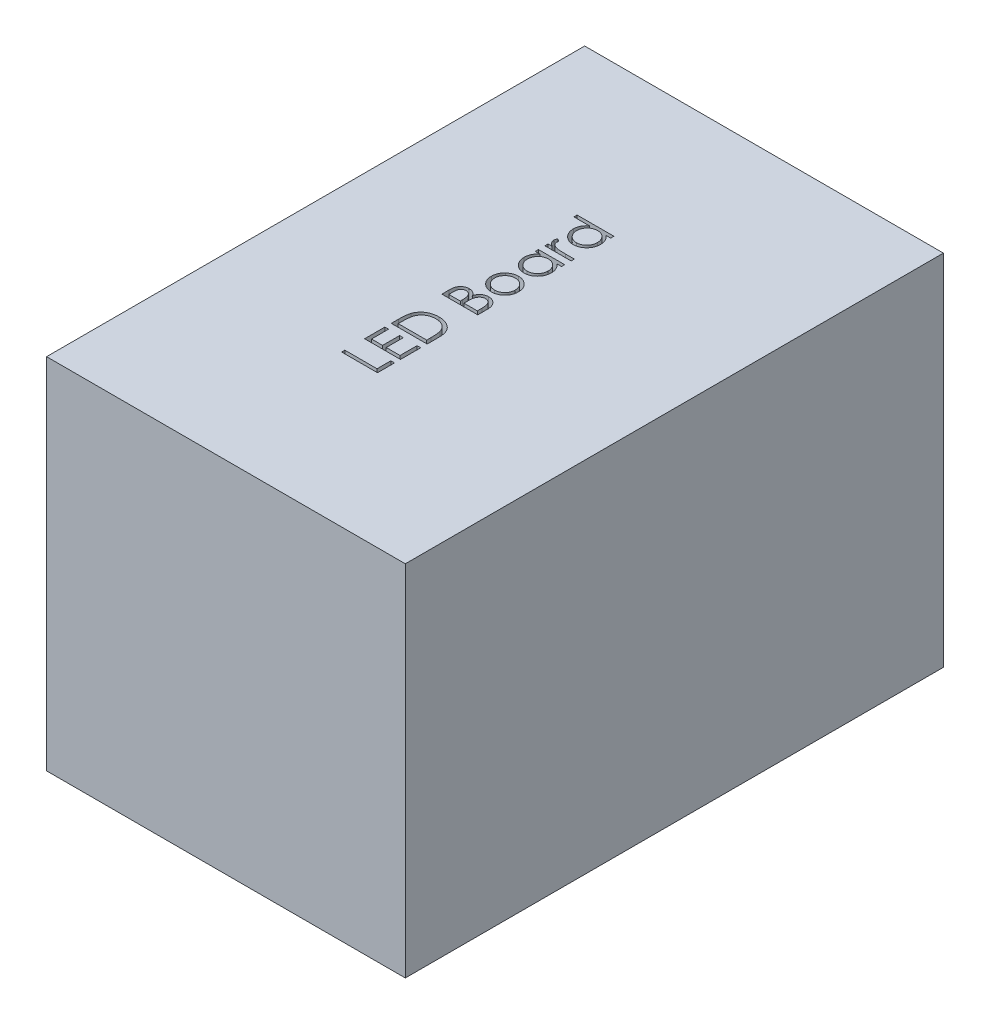
from build123d import *

# Parameters (mm, degrees)
SKETCH1_W           = 20
SKETCH1_H           = 30
BOSS_EXTRUDE1_DEPTH = 20
CUT_EXTRUDE1_DEPTH  = 2


with BuildPart() as part:
    # Sketch1 → Boss-Extrude1 (new body)
    with BuildSketch(Plane(origin=(0, 0, 0), x_dir=(1, 0, 0), z_dir=(0, 1, 0))):
        Rectangle(SKETCH1_W, SKETCH1_H)
    extrude(amount=BOSS_EXTRUDE1_DEPTH)

    # Sketch2 → Cut-Extrude1 (cut)
    # profile 1 of 8: a face of its own
    with BuildSketch(Plane(origin=(0, 20, 0), x_dir=(1, 0, 0), z_dir=(0, 1, 0))):
        Polygon((-2, -6.551282051), (-2, -6.371794872), (-0.205128205, -6.371794872), (-0.205128205, -5.602564103), (0, -5.602564103), (0, -6.551282051), align=None)
    # profile 2 of 8: a face of its own
    with BuildSketch(Plane(origin=(0, 20, 0), x_dir=(1, 0, 0), z_dir=(0, 1, 0))):
        Polygon((-2, -5.269230769), (-2, -4.141025641), (-1.794871795, -4.141025641), (-1.794871795, -5.08974359), (-1.179487179, -5.08974359), (-1.179487179, -4.141025641), (-0.974358974, -4.141025641), (-0.974358974, -5.08974359), (-0.205128205, -5.08974359), (-0.205128205, -4.141025641), (0, -4.141025641), (0, -5.269230769), align=None)
    # profile 3 of 8: a face of its own
    with BuildSketch(Plane(origin=(0, 20, 0), x_dir=(1, 0, 0), z_dir=(0, 1, 0))):
        with BuildLine():
            Line((0, -3.782051282), (-2, -3.782051282))
            Line((-2, -3.782051282), (-2, -3.378205128))
            add(Edge.make_bspline(
                [(-2, -3.378205128), (-1.999747103, -3.343079992), (-1.999258507, -3.275218412), (-1.996160569, -3.177154156), (-1.990680303, -3.086420578), (-1.982697717, -3.003316087), (-1.972895983, -2.927612537), (-1.960610038, -2.859521904), (-1.946102512, -2.798692108), (-1.933733683, -2.761280999), (-1.927884615, -2.743589744)],
                knots=[0, 0, 0, 0, 1.314313732, 2.53924729, 3.670748893, 4.714932338, 5.66265055, 6.526160246, 7.303039223, 8, 8, 8, 8], degree=3))
            add(Edge.make_bspline(
                [(-1.927884615, -2.743589744), (-1.919069815, -2.720447809), (-1.901640105, -2.674688721), (-1.868710928, -2.609572047), (-1.831553985, -2.54806308), (-1.789314193, -2.490652223), (-1.742543133, -2.437195425), (-1.691574936, -2.38708597), (-1.635277366, -2.341559304), (-1.574652486, -2.299906351), (-1.510477072, -2.262340673), (-1.442856226, -2.229690386), (-1.372138034, -2.202573639), (-1.298517891, -2.180063273), (-1.221834263, -2.162322426), (-1.141997764, -2.150218469), (-1.059323942, -2.142235045), (-1.003224249, -2.141432731), (-0.974759615, -2.141025641)],
                knots=[0, 0, 0, 0, 0.984741985, 1.947153288, 2.898543998, 3.841229145, 4.778974371, 5.722123648, 6.681464302, 7.655713756, 8.646344578, 9.637374342, 10.639946623, 11.656849581, 12.698333139, 13.76849723, 14.867749466, 16, 16, 16, 16], degree=3))
            add(Edge.make_bspline(
                [(-0.974759615, -2.141025641), (-0.950038908, -2.141385051), (-0.901324172, -2.142093307), (-0.829529371, -2.148452912), (-0.759864485, -2.157696538), (-0.692661185, -2.172007455), (-0.62733093, -2.189380512), (-0.564569078, -2.211645038), (-0.503803275, -2.237153612), (-0.445842752, -2.266886928), (-0.390965868, -2.299573558), (-0.339195829, -2.334432869), (-0.291681428, -2.372255442), (-0.247177572, -2.411921845), (-0.206873133, -2.454388626), (-0.170033415, -2.499138758), (-0.137275193, -2.546346154), (-0.108083705, -2.596303039), (-0.081978565, -2.649676602), (-0.060203746, -2.70814571), (-0.041344529, -2.771433407), (-0.026342022, -2.839900607), (-0.014242392, -2.913303108), (-0.006186412, -2.99184453), (-0.000722936, -3.075376442), (-0.000245658, -3.132736221), (0, -3.162259615)],
                knots=[0, 0, 0, 0, 1.106010661, 2.179509527, 3.223302912, 4.248870533, 5.252098245, 6.246278179, 7.226402005, 8.199283979, 9.158616973, 10.083547221, 10.989831858, 11.874256832, 12.749262829, 13.607058236, 14.46581075, 15.317568432, 16.194266721, 17.121067875, 18.106207572, 19.147242834, 20.255495536, 21.43354536, 22.679031616, 24, 24, 24, 24], degree=3))
            Line((0, -3.162259615), (0, -3.782051282))
        make_face()
        with BuildLine():
            Line((-0.205128205, -3.602564103), (-0.205128205, -3.372996795))
            add(Edge.make_bspline(
                [(-0.205128205, -3.372996795), (-0.205269974, -3.340009154), (-0.205542649, -3.276561841), (-0.207935336, -3.1853287), (-0.211845015, -3.101969045), (-0.217316488, -3.026471039), (-0.224555697, -2.958877311), (-0.23262707, -2.899046597), (-0.242682756, -2.847175021), (-0.25179759, -2.815786771), (-0.256009615, -2.801282051)],
                knots=[0, 0, 0, 0, 1.375205317, 2.645023457, 3.804390687, 4.853969522, 5.800190428, 6.637939096, 7.370582563, 8, 8, 8, 8], degree=3))
            add(Edge.make_bspline(
                [(-0.256009615, -2.801282051), (-0.262439076, -2.783025842), (-0.27514443, -2.746949474), (-0.298320254, -2.695017453), (-0.325772801, -2.646584778), (-0.35628862, -2.60080799), (-0.390942606, -2.558334235), (-0.428986447, -2.518668496), (-0.470593957, -2.481859335), (-0.515697668, -2.448473714), (-0.563808484, -2.418234025), (-0.615011493, -2.39227452), (-0.668586858, -2.369667192), (-0.724968301, -2.351766282), (-0.783742578, -2.337652199), (-0.845214457, -2.327759016), (-0.909329543, -2.321617179), (-0.952977429, -2.320884954), (-0.975160256, -2.320512821)],
                knots=[0, 0, 0, 0, 0.998590647, 1.973329978, 2.929871262, 3.868367705, 4.809062953, 5.754642869, 6.701828697, 7.672172887, 8.647399344, 9.630604387, 10.631475358, 11.644913558, 12.679592956, 13.747988925, 14.855477812, 16, 16, 16, 16], degree=3))
            add(Edge.make_bspline(
                [(-0.975160256, -2.320512821), (-0.998550817, -2.320806128), (-1.044501779, -2.321382332), (-1.111925034, -2.328624795), (-1.17677112, -2.339208541), (-1.239044374, -2.354513504), (-1.29886629, -2.374016864), (-1.35590601, -2.398356659), (-1.410765935, -2.426166156), (-1.462179858, -2.459253777), (-1.510804492, -2.495491259), (-1.555350158, -2.53570719), (-1.595918329, -2.57926264), (-1.633140794, -2.625682554), (-1.665520037, -2.676275183), (-1.694483855, -2.72984872), (-1.719064364, -2.787189104), (-1.732138, -2.827082073), (-1.738782051, -2.847355769)],
                knots=[0, 0, 0, 0, 1.122418816, 2.205001699, 3.251619955, 4.274784885, 5.280384055, 6.268708349, 7.249350384, 8.229342522, 9.199999885, 10.157847722, 11.105861043, 12.055065948, 13.010012805, 13.98527497, 14.976112212, 16, 16, 16, 16], degree=3))
            add(Edge.make_bspline(
                [(-1.738782051, -2.847355769), (-1.74342001, -2.864127853), (-1.753281583, -2.899789904), (-1.764038939, -2.957983884), (-1.773527224, -3.023478255), (-1.781560389, -3.096563799), (-1.787324573, -3.177157204), (-1.791651038, -3.265320454), (-1.794569114, -3.361091657), (-1.794768375, -3.427481676), (-1.794871795, -3.461939103)],
                knots=[0, 0, 0, 0, 0.674548936, 1.434276114, 2.292660221, 3.240891867, 4.284742987, 5.42552168, 6.663806718, 8, 8, 8, 8], degree=3))
            Line((-1.794871795, -3.461939103), (-1.794871795, -3.602564103))
            Line((-1.794871795, -3.602564103), (-0.205128205, -3.602564103))
        make_face(mode=Mode.SUBTRACT)
    # profile 4 of 8: a face of its own
    with BuildSketch(Plane(origin=(0, 20, 0), x_dir=(1, 0, 0), z_dir=(0, 1, 0))):
        with BuildLine():
            Line((-2, -0.961538462), (-2, -0.571314103))
            add(Edge.make_bspline(
                [(-2, -0.571314103), (-1.999901152, -0.552211814), (-1.999709561, -0.515186824), (-1.996669142, -0.461351237), (-1.992627192, -0.410909163), (-1.98584704, -0.363949739), (-1.978816916, -0.320167407), (-1.968498377, -0.280006649), (-1.957101175, -0.243131071), (-1.939565033, -0.198851048), (-1.912331183, -0.148609296), (-1.871940796, -0.094608812), (-1.823515983, -0.047668298), (-1.76833209, -0.007754946), (-1.707623553, 0.024276368), (-1.642696537, 0.047156445), (-1.574643362, 0.061855477), (-1.527986618, 0.063348178), (-1.504407051, 0.064102564)],
                knots=[0, 0, 0, 0, 1.00128172, 1.940733171, 2.826250472, 3.653024905, 4.427672124, 5.149348099, 5.824709082, 6.450061444, 7.643590664, 8.808605388, 9.972104426, 11.165284501, 12.367876273, 13.557044126, 14.765369432, 16, 16, 16, 16], degree=3))
            add(Edge.make_bspline(
                [(-1.504407051, 0.064102564), (-1.482320848, 0.063474215), (-1.438919375, 0.06223945), (-1.37554918, 0.050576038), (-1.31528783, 0.032064537), (-1.258186898, 0.006480896), (-1.205309323, -0.026482195), (-1.156818907, -0.06597661), (-1.114548319, -0.113428835), (-1.090925569, -0.148999183), (-1.078926282, -0.167067308)],
                knots=[0, 0, 0, 0, 1.044641374, 2.052818814, 3.038628718, 4.023282556, 5.005660861, 5.98021751, 6.974042014, 8, 8, 8, 8], degree=3))
            add(Edge.make_bspline(
                [(-1.078926282, -0.167067308), (-1.070200601, -0.144349257), (-1.053506212, -0.100883999), (-1.024036876, -0.041034958), (-0.99186828, 0.010340749), (-0.957281294, 0.05424672), (-0.919450363, 0.091599336), (-0.878068129, 0.123948861), (-0.83316847, 0.151915656), (-0.784916406, 0.175715205), (-0.733720991, 0.194410047), (-0.680207529, 0.208150497), (-0.624581161, 0.216278272), (-0.586831994, 0.217387026), (-0.567708333, 0.217948718)],
                knots=[0, 0, 0, 0, 1.272586185, 2.434772614, 3.483318042, 4.437947805, 5.351807173, 6.25737843, 7.180033415, 8.1141739, 9.066731021, 10.025721652, 10.999834114, 12, 12, 12, 12], degree=3))
            add(Edge.make_bspline(
                [(-0.567708333, 0.217948718), (-0.548184327, 0.217390642), (-0.509770297, 0.216292613), (-0.453339927, 0.208188029), (-0.399407215, 0.194474944), (-0.34764817, 0.175553582), (-0.298171311, 0.151028347), (-0.251155877, 0.120750571), (-0.206504053, 0.085145295), (-0.164137034, 0.044905577), (-0.12536988, 6.1559e-05), (-0.092043201, -0.049359434), (-0.063387007, -0.102003509), (-0.040056155, -0.15854367), (-0.022056419, -0.218835582), (-0.009515553, -0.282845695), (-0.001051358, -0.350468593), (-0.000356399, -0.396874505), (0, -0.420673077)],
                knots=[0, 0, 0, 0, 0.978680899, 1.925582087, 2.851223405, 3.764209995, 4.683484765, 5.614004905, 6.562443559, 7.542772147, 8.539900013, 9.527881485, 10.525548727, 11.540192123, 12.58875426, 13.674701727, 14.807505862, 16, 16, 16, 16], degree=3))
            Line((0, -0.420673077), (0, -0.961538462))
            Line((0, -0.961538462), (-2, -0.961538462))
        make_face()
        with BuildLine():
            Line((-1.794871795, -0.782051282), (-1.153846154, -0.782051282))
            Line((-1.153846154, -0.782051282), (-1.153846154, -0.661458333))
            add(Edge.make_bspline(
                [(-1.153846154, -0.661458333), (-1.154074681, -0.64383045), (-1.154516243, -0.609769788), (-1.15578111, -0.560444133), (-1.159322848, -0.514658407), (-1.162863574, -0.472491651), (-1.168620465, -0.434010235), (-1.17547316, -0.399299519), (-1.182720361, -0.367814406), (-1.195046513, -0.331506944), (-1.21325737, -0.290316635), (-1.241546573, -0.246434788), (-1.275214296, -0.20756975), (-1.314425563, -0.175143977), (-1.357133529, -0.148371661), (-1.402963256, -0.129616811), (-1.450992481, -0.117113511), (-1.484028274, -0.115966817), (-1.500801282, -0.115384615)],
                knots=[0, 0, 0, 0, 1.156917035, 2.235399477, 3.236897345, 4.169954739, 5.01148057, 5.788325709, 6.491867502, 7.129259015, 8.302032419, 9.437271567, 10.542795419, 11.662606952, 12.764338259, 13.836858145, 14.901724648, 16, 16, 16, 16], degree=3))
            add(Edge.make_bspline(
                [(-1.500801282, -0.115384615), (-1.511903178, -0.115680222), (-1.533680759, -0.116260086), (-1.565530584, -0.121181699), (-1.595457737, -0.129156019), (-1.623749443, -0.139955398), (-1.649702587, -0.154708952), (-1.674557276, -0.17181026), (-1.696824835, -0.192924252), (-1.717577313, -0.216784938), (-1.736150711, -0.244085819), (-1.751535893, -0.275415092), (-1.765479979, -0.309962848), (-1.775802372, -0.348666387), (-1.784879298, -0.390723757), (-1.790582391, -0.436704433), (-1.794252386, -0.486317042), (-1.79466072, -0.520692349), (-1.794871795, -0.538461538)],
                knots=[0, 0, 0, 0, 0.911708768, 1.788416306, 2.640049961, 3.452993646, 4.268229297, 5.087074648, 5.92553149, 6.781184137, 7.681934069, 8.628939405, 9.643570426, 10.73771997, 11.914765019, 13.176320755, 14.540391495, 16, 16, 16, 16], degree=3))
            Line((-1.794871795, -0.538461538), (-1.794871795, -0.782051282))
        make_face(mode=Mode.SUBTRACT)
        with BuildLine():
            Line((-0.948717949, -0.782051282), (-0.205128205, -0.782051282))
            Line((-0.205128205, -0.782051282), (-0.205128205, -0.526442308))
            add(Edge.make_bspline(
                [(-0.205128205, -0.526442308), (-0.205369294, -0.508147692), (-0.20583396, -0.472887233), (-0.206923699, -0.421937095), (-0.211046015, -0.374837423), (-0.214848834, -0.331439635), (-0.22135149, -0.291858908), (-0.227488307, -0.255790784), (-0.236597974, -0.223827348), (-0.249118138, -0.186422732), (-0.269161368, -0.144613018), (-0.298444337, -0.098922525), (-0.334584041, -0.059081124), (-0.37568611, -0.024881), (-0.420253296, 0.003342427), (-0.467702967, 0.023595406), (-0.517112318, 0.036181329), (-0.550809043, 0.037699939), (-0.567708333, 0.038461538)],
                knots=[0, 0, 0, 0, 1.160376723, 2.23647316, 3.230273494, 4.158083346, 4.997711197, 5.773399541, 6.476071462, 7.102777513, 8.27340052, 9.405620712, 10.53304798, 11.669441455, 12.787990954, 13.865552736, 14.929550474, 16, 16, 16, 16], degree=3))
            add(Edge.make_bspline(
                [(-0.567708333, 0.038461538), (-0.578276184, 0.038304248), (-0.599241425, 0.037992203), (-0.630047147, 0.033264808), (-0.659902762, 0.026425765), (-0.688932685, 0.017418548), (-0.716648815, 0.004826945), (-0.743157444, -0.010609306), (-0.76899258, -0.028278837), (-0.80207671, -0.055539581), (-0.83972186, -0.095769486), (-0.876123519, -0.152940669), (-0.905954326, -0.217587407), (-0.918565514, -0.264584629), (-0.925080128, -0.288862179)],
                knots=[0, 0, 0, 0, 0.723302347, 1.434937762, 2.129609326, 2.821140842, 3.513216847, 4.209993937, 4.920569932, 5.655069131, 7.14393391, 8.6716197, 10.280644748, 12, 12, 12, 12], degree=3))
            add(Edge.make_bspline(
                [(-0.925080128, -0.288862179), (-0.927054462, -0.298593091), (-0.931335225, -0.319691716), (-0.935853912, -0.354096047), (-0.939879661, -0.393373687), (-0.942857465, -0.437615331), (-0.94593549, -0.486876954), (-0.947132531, -0.541263765), (-0.948560679, -0.600553659), (-0.948664185, -0.641692158), (-0.948717949, -0.663060897)],
                knots=[0, 0, 0, 0, 0.634451884, 1.375622551, 2.216452059, 3.157844607, 4.20941857, 5.370758133, 6.634282058, 8, 8, 8, 8], degree=3))
            Line((-0.948717949, -0.663060897), (-0.948717949, -0.782051282))
        make_face(mode=Mode.SUBTRACT)
    # profile 5 of 8: a face of its own
    with BuildSketch(Plane(origin=(0, 20, 0), x_dir=(1, 0, 0), z_dir=(0, 1, 0))):
        with BuildLine():
            add(Edge.make_bspline(
                [(-1.487179487, 1.282852564), (-1.486595549, 1.310276149), (-1.48545059, 1.364047096), (-1.473213467, 1.442794459), (-1.454500687, 1.517963108), (-1.428631223, 1.589840932), (-1.393955823, 1.657507387), (-1.352579085, 1.721948098), (-1.30356046, 1.782986389), (-1.265641564, 1.819570977), (-1.246394231, 1.838141026)],
                knots=[0, 0, 0, 0, 1.054011418, 2.066658804, 3.057071809, 4.030435133, 4.997543892, 5.974964718, 6.972108034, 8, 8, 8, 8], degree=3))
            add(Edge.make_bspline(
                [(-1.246394231, 1.838141026), (-1.227986239, 1.854130714), (-1.1915265, 1.885800645), (-1.132409007, 1.926409627), (-1.071186093, 1.961393376), (-1.007044763, 1.989429354), (-0.940544951, 2.011535082), (-0.871458088, 2.027229765), (-0.799936746, 2.036565157), (-0.751363125, 2.037823995), (-0.726762821, 2.038461538)],
                knots=[0, 0, 0, 0, 1.025258237, 2.030674902, 3.01204498, 3.988269485, 4.97094183, 5.956517959, 6.965070386, 8, 8, 8, 8], degree=3))
            add(Edge.make_bspline(
                [(-0.726762821, 2.038461538), (-0.70201993, 2.037900774), (-0.653126826, 2.036792678), (-0.581115759, 2.026310612), (-0.511290147, 2.010007134), (-0.443942322, 1.986674655), (-0.37886642, 1.956755735), (-0.316346678, 1.920246771), (-0.256259744, 1.876891561), (-0.199115837, 1.82774642), (-0.146449428, 1.773431063), (-0.10054756, 1.714507549), (-0.061220975, 1.652133816), (-0.029543023, 1.585480471), (-0.004566051, 1.515156193), (0.012976815, 1.441009297), (0.023583492, 1.363154971), (0.024945534, 1.309996559), (0.025641026, 1.282852564)],
                knots=[0, 0, 0, 0, 0.998656419, 1.973391657, 2.932242238, 3.890759089, 4.846373663, 5.82037756, 6.809684879, 7.83454468, 8.860553229, 9.859544525, 10.845671541, 11.83227036, 12.833544569, 13.85385346, 14.904124723, 16, 16, 16, 16], degree=3))
            add(Edge.make_bspline(
                [(0.025641026, 1.282852564), (0.024943199, 1.255575582), (0.023576471, 1.202152233), (0.013018024, 1.124023101), (-0.004557966, 1.049743318), (-0.029625105, 0.979326976), (-0.061221987, 0.912387064), (-0.100428667, 0.849651923), (-0.146463041, 0.790680542), (-0.199112148, 0.736353694), (-0.256260695, 0.687211634), (-0.316346431, 0.643855629), (-0.378866484, 0.607346871), (-0.443942304, 0.577427898), (-0.511290151, 0.554095433), (-0.581115758, 0.537791952), (-0.653126826, 0.527309886), (-0.702019931, 0.52620179), (-0.726762821, 0.525641026)],
                knots=[0, 0, 0, 0, 1.099876186, 2.154163076, 3.173186993, 4.173200201, 5.163417411, 6.152872554, 7.150605724, 8.17532212, 9.198891216, 10.186952605, 11.159729845, 12.11414092, 13.071450619, 14.029093627, 15.002601286, 16, 16, 16, 16], degree=3))
            add(Edge.make_bspline(
                [(-0.726762821, 0.525641026), (-0.751229964, 0.526281392), (-0.799670703, 0.527549208), (-0.871049675, 0.536897339), (-0.939925092, 0.552421253), (-1.006061762, 0.574833429), (-1.070048929, 0.602817364), (-1.13149632, 0.637449016), (-1.190355495, 0.678450822), (-1.226766883, 0.709997716), (-1.245192308, 0.725961538)],
                knots=[0, 0, 0, 0, 1.031377469, 2.041950136, 3.029500481, 4.003457997, 4.981637986, 5.969878303, 6.97268806, 8, 8, 8, 8], degree=3))
            add(Edge.make_bspline(
                [(-1.245192308, 0.725961538), (-1.264606559, 0.74450359), (-1.302788099, 0.780969798), (-1.351663827, 0.842311929), (-1.393901584, 0.906594112), (-1.427887993, 0.975008356), (-1.45465286, 1.046827131), (-1.473261726, 1.122380984), (-1.4854065, 1.201395565), (-1.486582602, 1.255429634), (-1.487179487, 1.282852564)],
                knots=[0, 0, 0, 0, 1.027980169, 2.021703884, 2.998553061, 3.971491411, 4.943284454, 5.930300938, 6.949603206, 8, 8, 8, 8], degree=3))
        make_face()
        with BuildLine():
            add(Edge.make_bspline(
                [(-1.307692308, 1.282051282), (-1.307141112, 1.262658361), (-1.306052951, 1.224373145), (-1.297776434, 1.168019097), (-1.284663575, 1.113767578), (-1.266032682, 1.061515675), (-1.241976182, 1.011439547), (-1.212428496, 0.963491431), (-1.177781293, 0.917529594), (-1.13808756, 0.874455845), (-1.094731021, 0.834916729), (-1.048521534, 0.800380879), (-1.000166932, 0.770849008), (-0.949594451, 0.746693691), (-0.896631658, 0.728168277), (-0.841590451, 0.715040818), (-0.784304626, 0.706749146), (-0.745354277, 0.705674372), (-0.725560897, 0.705128205)],
                knots=[0, 0, 0, 0, 1.02155314, 2.01673505, 2.994700672, 3.958461264, 4.934171024, 5.916582427, 6.921469794, 7.962398674, 8.998583302, 10.009097305, 10.997513862, 11.97957236, 12.956600784, 13.948243505, 14.957359924, 16, 16, 16, 16], degree=3))
            add(Edge.make_bspline(
                [(-0.725560897, 0.705128205), (-0.69998831, 0.70604639), (-0.649231507, 0.707868815), (-0.574482294, 0.722688951), (-0.502721236, 0.747481111), (-0.434369015, 0.780959556), (-0.371127714, 0.822905967), (-0.314744008, 0.872327148), (-0.266066402, 0.928692691), (-0.225677347, 0.991330691), (-0.193586058, 1.05896173), (-0.170843786, 1.13053677), (-0.156059962, 1.205188595), (-0.154590548, 1.256206156), (-0.153846154, 1.282051282)],
                knots=[0, 0, 0, 0, 1.016792936, 2.018143844, 3.017858371, 4.030088057, 5.03801393, 6.028138512, 7.003788237, 7.991172063, 8.984598303, 9.972568034, 10.972917682, 12, 12, 12, 12], degree=3))
            add(Edge.make_bspline(
                [(-0.153846154, 1.282051282), (-0.154594885, 1.307894921), (-0.156072861, 1.358909548), (-0.170769329, 1.433457649), (-0.193685707, 1.504837061), (-0.225641255, 1.572397854), (-0.266219778, 1.635007342), (-0.314469136, 1.691778268), (-0.371277051, 1.740777475), (-0.434452782, 1.782682392), (-0.502615269, 1.816709102), (-0.574495539, 1.841385217), (-0.649228134, 1.856240981), (-0.69998718, 1.858058597), (-0.725560897, 1.858974359)],
                knots=[0, 0, 0, 0, 1.02726834, 2.027799167, 3.010890988, 4.004497153, 4.992059811, 5.971914811, 6.958719428, 7.966827853, 8.981595046, 9.981490638, 10.983022906, 12, 12, 12, 12], degree=3))
            add(Edge.make_bspline(
                [(-0.725560897, 1.858974359), (-0.745354395, 1.85842838), (-0.784304977, 1.857353977), (-0.84158911, 1.849059609), (-0.896636564, 1.835942107), (-0.949576384, 1.817380076), (-1.000298142, 1.793332055), (-1.048379792, 1.763232468), (-1.094891057, 1.728837677), (-1.137947399, 1.688821529), (-1.177796766, 1.645792737), (-1.212441931, 1.599812275), (-1.241846323, 1.551935258), (-1.266238447, 1.502004609), (-1.284494074, 1.449746007), (-1.297852148, 1.395570503), (-1.306017975, 1.339456898), (-1.307130627, 1.301308873), (-1.307692308, 1.282051282)],
                knots=[0, 0, 0, 0, 1.042975879, 2.052417305, 3.044379404, 4.0217225, 5.00409729, 5.996508862, 7.007348322, 8.048612455, 9.089876587, 10.095087598, 11.077815406, 12.047498138, 13.018202342, 13.98964644, 14.985148868, 16, 16, 16, 16], degree=3))
        make_face(mode=Mode.SUBTRACT)
    # profile 6 of 8: a face of its own
    with BuildSketch(Plane(origin=(0, 20, 0), x_dir=(1, 0, 0), z_dir=(0, 1, 0))):
        with BuildLine():
            Line((-1.461538462, 3.884615385), (0, 3.884615385))
            Line((0, 3.884615385), (0, 3.705128205))
            Line((0, 3.705128205), (-0.252804487, 3.705128205))
            add(Edge.make_bspline(
                [(-0.252804487, 3.705128205), (-0.229962419, 3.684857299), (-0.185319545, 3.645239543), (-0.126461954, 3.579693934), (-0.078803458, 3.509351893), (-0.039753095, 3.43597851), (-0.010538305, 3.358855072), (0.010263999, 3.278384681), (0.023629123, 3.194490456), (0.024964375, 3.137203672), (0.025641026, 3.108173077)],
                knots=[0, 0, 0, 0, 1.074325654, 2.099677833, 3.090439787, 4.057542011, 5.018572219, 5.985274637, 6.979019747, 8, 8, 8, 8], degree=3))
            add(Edge.make_bspline(
                [(0.025641026, 3.108173077), (0.024940241, 3.082362818), (0.023558264, 3.031463843), (0.012836948, 2.956590085), (-0.00438055, 2.884537371), (-0.028323916, 2.815237615), (-0.060084385, 2.749139246), (-0.098107956, 2.685676334), (-0.14338843, 2.625177653), (-0.195153018, 2.568565345), (-0.251378724, 2.516432773), (-0.311347608, 2.470683475), (-0.374800354, 2.432538858), (-0.440933584, 2.400641669), (-0.510256395, 2.376072329), (-0.582529063, 2.358944538), (-0.657666133, 2.348235711), (-0.708831575, 2.346854305), (-0.734775641, 2.346153846)],
                knots=[0, 0, 0, 0, 1.033919861, 2.038935746, 3.024066025, 3.998881131, 4.97069526, 5.957263378, 6.95902576, 7.993208707, 9.027059324, 10.027763471, 11.009749337, 11.988697705, 12.965288445, 13.950418724, 14.960734635, 16, 16, 16, 16], degree=3))
            add(Edge.make_bspline(
                [(-0.734775641, 2.346153846), (-0.760183472, 2.34686983), (-0.810413382, 2.348285291), (-0.884286924, 2.358829988), (-0.955440216, 2.376561993), (-1.023644183, 2.401446477), (-1.088981355, 2.433356166), (-1.15149794, 2.472172216), (-1.211366168, 2.51789743), (-1.267178297, 2.570613091), (-1.318732934, 2.627718674), (-1.363538103, 2.688809377), (-1.402233445, 2.752365538), (-1.432892574, 2.819372972), (-1.457697777, 2.888839889), (-1.474859473, 2.961384716), (-1.484972228, 3.036705618), (-1.486436665, 3.087843042), (-1.487179487, 3.113782051)],
                knots=[0, 0, 0, 0, 1.020392517, 2.01726096, 2.990465484, 3.961182959, 4.928053699, 5.906110375, 6.912531644, 7.948652711, 8.985773172, 9.998621852, 10.987621588, 11.969261332, 12.953316658, 13.946091881, 14.958173133, 16, 16, 16, 16], degree=3))
            add(Edge.make_bspline(
                [(-1.487179487, 3.113782051), (-1.486357, 3.143609977), (-1.484744141, 3.202101132), (-1.471349807, 3.287667982), (-1.448652067, 3.368578554), (-1.417990195, 3.44569179), (-1.376392304, 3.517946248), (-1.325386481, 3.586241387), (-1.262863963, 3.649124225), (-1.21543894, 3.68613728), (-1.191105769, 3.705128205)],
                knots=[0, 0, 0, 0, 1.039007978, 2.037445607, 3.008437381, 3.96246474, 4.921201921, 5.904967172, 6.925065498, 8, 8, 8, 8], degree=3))
            Line((-1.191105769, 3.705128205), (-1.461538462, 3.705128205))
            Line((-1.461538462, 3.705128205), (-1.461538462, 3.884615385))
        make_face()
        with BuildLine():
            add(Edge.make_bspline(
                [(-1.307692308, 3.116185897), (-1.306758001, 3.089949698), (-1.30491383, 3.038163612), (-1.290540529, 2.962130302), (-1.266563058, 2.889410464), (-1.233962877, 2.820117178), (-1.192192741, 2.75618273), (-1.142979808, 2.698040195), (-1.085493382, 2.647482333), (-1.021790739, 2.604002693), (-0.953120856, 2.569098266), (-0.88136033, 2.544398684), (-0.807751066, 2.528138986), (-0.757830388, 2.526475847), (-0.732772436, 2.525641026)],
                knots=[0, 0, 0, 0, 1.031130969, 2.035288524, 3.029955243, 4.035265425, 5.037320146, 6.024362013, 7.021230137, 8.037832003, 9.049975902, 10.039737725, 11.016035826, 12, 12, 12, 12], degree=3))
            add(Edge.make_bspline(
                [(-0.732772436, 2.525641026), (-0.707865376, 2.526710979), (-0.658148885, 2.528846693), (-0.584545939, 2.54404269), (-0.512946494, 2.569870989), (-0.443724789, 2.604728218), (-0.3793997, 2.64871958), (-0.320880752, 2.699229358), (-0.270898021, 2.757651632), (-0.229027187, 2.822157694), (-0.195225603, 2.89108295), (-0.171700919, 2.963557798), (-0.156513999, 3.038230033), (-0.15473996, 3.089002736), (-0.153846154, 3.114583333)],
                knots=[0, 0, 0, 0, 0.979154007, 1.954470061, 2.941101473, 3.965068436, 4.993389179, 5.998216918, 6.996159742, 8.005560442, 9.015493761, 10.005250788, 10.994993882, 12, 12, 12, 12], degree=3))
            add(Edge.make_bspline(
                [(-0.153846154, 3.114583333), (-0.154805663, 3.140549225), (-0.156714031, 3.192192808), (-0.171006012, 3.268536595), (-0.195514187, 3.342370859), (-0.228450639, 3.413191934), (-0.269473838, 3.479103233), (-0.317500922, 3.53805902), (-0.372971978, 3.588500232), (-0.434643565, 3.630496232), (-0.501822981, 3.663801113), (-0.573274006, 3.688153215), (-0.649141668, 3.702391244), (-0.701061842, 3.70420327), (-0.727564103, 3.705128205)],
                knots=[0, 0, 0, 0, 1.01787422, 2.024450869, 3.03297362, 4.061474925, 5.080076323, 6.069755756, 7.033548292, 8.009625779, 8.9862229, 9.964937832, 10.961217871, 12, 12, 12, 12], degree=3))
            add(Edge.make_bspline(
                [(-0.727564103, 3.705128205), (-0.747757149, 3.70457983), (-0.787503453, 3.703500454), (-0.845862035, 3.695254415), (-0.901709878, 3.682137314), (-0.955105701, 3.663653788), (-1.005754281, 3.639373054), (-1.054019287, 3.610088617), (-1.099649693, 3.575285502), (-1.142017162, 3.535523962), (-1.180660855, 3.492000989), (-1.215154707, 3.445946966), (-1.243491148, 3.396816253), (-1.266943304, 3.345435089), (-1.285605675, 3.291714327), (-1.298055786, 3.23521683), (-1.306604541, 3.176543123), (-1.307325901, 3.136516805), (-1.307692308, 3.116185897)],
                knots=[0, 0, 0, 0, 1.050140795, 2.067009409, 3.05949893, 4.030605086, 5.00011959, 5.97591094, 6.962425594, 7.979863591, 8.993523472, 9.986985069, 10.967611495, 11.937549037, 12.921786183, 13.919465291, 14.943216303, 16, 16, 16, 16], degree=3))
        make_face(mode=Mode.SUBTRACT)
    # profile 7 of 8: a face of its own
    with BuildSketch(Plane(origin=(0, 20, 0), x_dir=(1, 0, 0), z_dir=(0, 1, 0))):
        with BuildLine():
            Line((-1.461538462, 4.243589744), (-1.461538462, 4.423076923))
            Line((-1.461538462, 4.423076923), (-1.246394231, 4.423076923))
            add(Edge.make_bspline(
                [(-1.246394231, 4.423076923), (-1.2664351, 4.436319164), (-1.304763108, 4.461644847), (-1.355386319, 4.503936171), (-1.397778978, 4.546793071), (-1.431132652, 4.591340889), (-1.456339885, 4.637142869), (-1.474052217, 4.683812787), (-1.485036174, 4.731464768), (-1.486464092, 4.763565032), (-1.487179487, 4.779647436)],
                knots=[0, 0, 0, 0, 1.280091057, 2.448164201, 3.510831157, 4.48793739, 5.405868014, 6.289422536, 7.142991551, 8, 8, 8, 8], degree=3))
            add(Edge.make_bspline(
                [(-1.487179487, 4.779647436), (-1.486499186, 4.792119622), (-1.485099423, 4.817781957), (-1.475264666, 4.856629151), (-1.459562939, 4.896653981), (-1.444797097, 4.922449631), (-1.437099359, 4.935897436)],
                knots=[0, 0, 0, 0, 0.901110191, 1.854092781, 2.881294221, 4, 4, 4, 4], degree=3))
            Line((-1.437099359, 4.935897436), (-1.281650641, 4.837339744))
            add(Edge.make_bspline(
                [(-1.281650641, 4.837339744), (-1.285502222, 4.828706017), (-1.292813259, 4.812317552), (-1.301465836, 4.788343514), (-1.306560645, 4.766239893), (-1.307332484, 4.75215786), (-1.307692308, 4.745592949)],
                knots=[0, 0, 0, 0, 1.180555205, 2.24091978, 3.179933427, 4, 4, 4, 4], degree=3))
            add(Edge.make_bspline(
                [(-1.307692308, 4.745592949), (-1.306739804, 4.731185348), (-1.304796974, 4.701798019), (-1.289305165, 4.658797257), (-1.264994983, 4.616697043), (-1.237312873, 4.583583766), (-1.210721786, 4.557854129), (-1.18744872, 4.539350027), (-1.161111118, 4.52274232), (-1.132726985, 4.506632404), (-1.101583961, 4.491665075), (-1.06763124, 4.478289568), (-1.031149191, 4.465780894), (-1.005782372, 4.458736585), (-0.992788462, 4.455128205)],
                knots=[0, 0, 0, 0, 1.125322384, 2.295331465, 3.535939348, 4.916963136, 5.656144286, 6.429838446, 7.238666481, 8.090384391, 8.983239461, 9.940052224, 10.944811494, 12, 12, 12, 12], degree=3))
            add(Edge.make_bspline(
                [(-0.992788462, 4.455128205), (-0.981202147, 4.452419307), (-0.955410648, 4.446389215), (-0.912337848, 4.440682704), (-0.86148149, 4.434817342), (-0.802782493, 4.430811891), (-0.736015218, 4.427028207), (-0.661467698, 4.424937945), (-0.578935039, 4.423143428), (-0.521368833, 4.423099799), (-0.491185897, 4.423076923)],
                knots=[0, 0, 0, 0, 0.566841273, 1.261806378, 2.068780918, 3.007109044, 4.065315289, 5.256255371, 6.561408263, 8, 8, 8, 8], degree=3))
            Line((-0.491185897, 4.423076923), (0, 4.423076923))
            Line((0, 4.423076923), (0, 4.243589744))
            Line((0, 4.243589744), (-1.461538462, 4.243589744))
        make_face()
    # profile 8 of 8: a face of its own
    with BuildSketch(Plane(origin=(0, 20, 0), x_dir=(1, 0, 0), z_dir=(0, 1, 0))):
        with BuildLine():
            Line((-2.051282051, 6.628205128), (0, 6.628205128))
            Line((0, 6.628205128), (0, 6.448717949))
            Line((0, 6.448717949), (-0.252804487, 6.448717949))
            add(Edge.make_bspline(
                [(-0.252804487, 6.448717949), (-0.229962419, 6.428447043), (-0.185319545, 6.388829287), (-0.126461954, 6.323283678), (-0.078803458, 6.252941637), (-0.039753095, 6.179568253), (-0.010538305, 6.102444816), (0.010263999, 6.021974425), (0.023629123, 5.938080199), (0.024964375, 5.880793415), (0.025641026, 5.851762821)],
                knots=[0, 0, 0, 0, 1.074325654, 2.099677833, 3.090439787, 4.057542011, 5.018572219, 5.985274637, 6.979019747, 8, 8, 8, 8], degree=3))
            add(Edge.make_bspline(
                [(0.025641026, 5.851762821), (0.024940241, 5.825952561), (0.023558264, 5.775053587), (0.012836948, 5.700179829), (-0.00438055, 5.628127115), (-0.028323916, 5.558827359), (-0.060084385, 5.49272899), (-0.098107956, 5.429266078), (-0.14338843, 5.368767396), (-0.195153018, 5.312155088), (-0.251378724, 5.260022517), (-0.311347608, 5.214273218), (-0.374800354, 5.176128601), (-0.440933584, 5.144231412), (-0.510256395, 5.119662072), (-0.582529063, 5.102534281), (-0.657666133, 5.091825455), (-0.708831575, 5.090444049), (-0.734775641, 5.08974359)],
                knots=[0, 0, 0, 0, 1.033919861, 2.038935746, 3.024066025, 3.998881131, 4.97069526, 5.957263378, 6.95902576, 7.993208707, 9.027059324, 10.027763471, 11.009749337, 11.988697705, 12.965288445, 13.950418724, 14.960734635, 16, 16, 16, 16], degree=3))
            add(Edge.make_bspline(
                [(-0.734775641, 5.08974359), (-0.760183472, 5.090459573), (-0.810413382, 5.091875034), (-0.884286924, 5.102419731), (-0.955440216, 5.120151736), (-1.023644183, 5.145036221), (-1.088981355, 5.176945909), (-1.15149794, 5.215761959), (-1.211366168, 5.261487173), (-1.267178297, 5.314202834), (-1.318732934, 5.371308417), (-1.363538103, 5.432399121), (-1.402233445, 5.495955281), (-1.432892574, 5.562962716), (-1.457697777, 5.632429633), (-1.474859473, 5.704974459), (-1.484972228, 5.780295361), (-1.486436665, 5.831432785), (-1.487179487, 5.857371795)],
                knots=[0, 0, 0, 0, 1.020392517, 2.01726096, 2.990465484, 3.961182959, 4.928053699, 5.906110375, 6.912531644, 7.948652711, 8.985773172, 9.998621852, 10.987621588, 11.969261332, 12.953316658, 13.946091881, 14.958173133, 16, 16, 16, 16], degree=3))
            add(Edge.make_bspline(
                [(-1.487179487, 5.857371795), (-1.48629542, 5.887213201), (-1.484560094, 5.945788566), (-1.4697153, 6.031360953), (-1.44566327, 6.112515453), (-1.411846191, 6.189425484), (-1.367460119, 6.261416626), (-1.31454749, 6.329684173), (-1.250895871, 6.3925088), (-1.203122867, 6.429695905), (-1.178685897, 6.448717949)],
                knots=[0, 0, 0, 0, 1.030935089, 2.023611011, 2.991955418, 3.950956655, 4.918431382, 5.908366361, 6.930082213, 8, 8, 8, 8], degree=3))
            Line((-1.178685897, 6.448717949), (-2.051282051, 6.448717949))
            Line((-2.051282051, 6.448717949), (-2.051282051, 6.628205128))
        make_face()
        with BuildLine():
            add(Edge.make_bspline(
                [(-1.307692308, 5.859775641), (-1.306758001, 5.833539441), (-1.30491383, 5.781753356), (-1.290540529, 5.705720046), (-1.266563058, 5.633000208), (-1.233962877, 5.563706921), (-1.192192741, 5.499772474), (-1.142979808, 5.441629938), (-1.085493382, 5.391072076), (-1.021790739, 5.347592437), (-0.953120856, 5.31268801), (-0.88136033, 5.287988428), (-0.807751066, 5.27172873), (-0.757830388, 5.270065591), (-0.732772436, 5.269230769)],
                knots=[0, 0, 0, 0, 1.031130969, 2.035288524, 3.029955243, 4.035265425, 5.037320146, 6.024362013, 7.021230137, 8.037832003, 9.049975902, 10.039737725, 11.016035826, 12, 12, 12, 12], degree=3))
            add(Edge.make_bspline(
                [(-0.732772436, 5.269230769), (-0.707865376, 5.270300723), (-0.658148885, 5.272436437), (-0.584545939, 5.287632434), (-0.512946494, 5.313460733), (-0.443724789, 5.348317962), (-0.3793997, 5.392309323), (-0.320880752, 5.442819102), (-0.270898021, 5.501241376), (-0.229027187, 5.565747438), (-0.195225603, 5.634672693), (-0.171700919, 5.707147542), (-0.156513999, 5.781819777), (-0.15473996, 5.832592479), (-0.153846154, 5.858173077)],
                knots=[0, 0, 0, 0, 0.979154007, 1.954470061, 2.941101473, 3.965068436, 4.993389179, 5.998216918, 6.996159742, 8.005560442, 9.015493761, 10.005250788, 10.994993882, 12, 12, 12, 12], degree=3))
            add(Edge.make_bspline(
                [(-0.153846154, 5.858173077), (-0.154805663, 5.884138969), (-0.156714031, 5.935782552), (-0.171006012, 6.012126339), (-0.195514187, 6.085960603), (-0.228450639, 6.156781678), (-0.269473838, 6.222692977), (-0.317500922, 6.281648763), (-0.372971978, 6.332089976), (-0.434643565, 6.374085976), (-0.501822981, 6.407390856), (-0.573274006, 6.431742959), (-0.649141668, 6.445980987), (-0.701061842, 6.447793014), (-0.727564103, 6.448717949)],
                knots=[0, 0, 0, 0, 1.01787422, 2.024450869, 3.03297362, 4.061474925, 5.080076323, 6.069755756, 7.033548292, 8.009625779, 8.9862229, 9.964937832, 10.961217871, 12, 12, 12, 12], degree=3))
            add(Edge.make_bspline(
                [(-0.727564103, 6.448717949), (-0.747757149, 6.448169574), (-0.787503453, 6.447090198), (-0.845862035, 6.438844158), (-0.901709878, 6.425727057), (-0.955105701, 6.407243532), (-1.005754281, 6.382962798), (-1.054019287, 6.35367836), (-1.099649693, 6.318875246), (-1.142017162, 6.279113705), (-1.180660855, 6.235590732), (-1.215154707, 6.189536709), (-1.243491148, 6.140405997), (-1.266943304, 6.089024833), (-1.285605675, 6.03530407), (-1.298055786, 5.978806573), (-1.306604541, 5.920132866), (-1.307325901, 5.880106549), (-1.307692308, 5.859775641)],
                knots=[0, 0, 0, 0, 1.050140795, 2.067009409, 3.05949893, 4.030605086, 5.00011959, 5.97591094, 6.962425594, 7.979863591, 8.993523472, 9.986985069, 10.967611495, 11.937549037, 12.921786183, 13.919465291, 14.943216303, 16, 16, 16, 16], degree=3))
        make_face(mode=Mode.SUBTRACT)
    extrude(amount=-CUT_EXTRUDE1_DEPTH, mode=Mode.SUBTRACT)


solid = part.part
